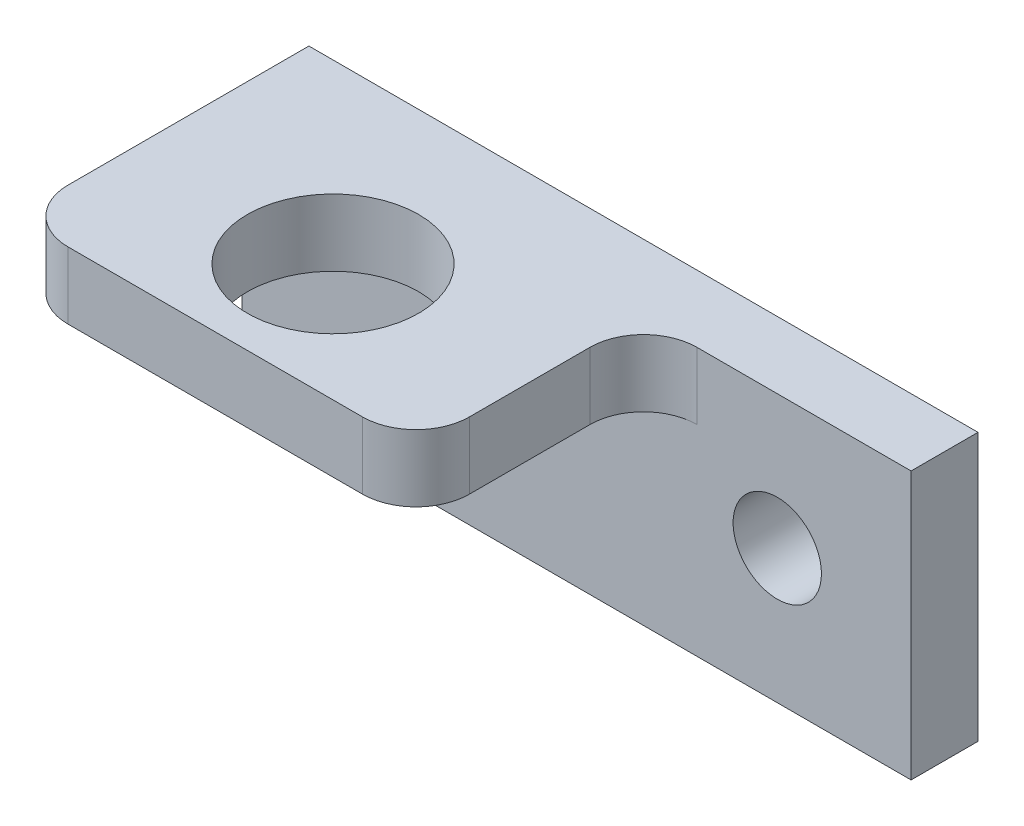
from build123d import *

# Parameters (mm, degrees)
SKIZZE1_W                       = 25
SKIZZE1_H                       = 10
SKIZZE1_R                       = 1.65
AUFSATZ_LINEAR_AUSTRAGEN1_DEPTH = 2.5
SKIZZE2_W                       = 15
SKIZZE2_H                       = 2.5
AUFSATZ_LINEAR_AUSTRAGEN2_DEPTH = 8.5
VERRUNDUNG1_R                   = 2
SKIZZE3_R                       = 3.2
SCHNITT_LINEAR_AUSTRAGEN1_DEPTH = 8.5


with BuildPart() as part:
    # Skizze1 → Aufsatz-Linear austragen1 (new body)
    with BuildSketch(Plane.XY):
        with Locations((12.5, 5)):
            Rectangle(SKIZZE1_W, SKIZZE1_H)
        with Locations((20, 5)):
            Circle(SKIZZE1_R, mode=Mode.SUBTRACT)
    extrude(amount=AUFSATZ_LINEAR_AUSTRAGEN1_DEPTH)

    # Skizze2 → Aufsatz-Linear austragen2 (add)
    with BuildSketch(Plane.XY.offset(2.5)):
        with Locations((7.5, 8.75)):
            Rectangle(SKIZZE2_W, SKIZZE2_H)
    extrude(amount=AUFSATZ_LINEAR_AUSTRAGEN2_DEPTH)

    # Verrundung1
    verrundung1_edges = [part.edges().sort_by_distance(p)[0] for p in [
        (15, 8.75, 2.5),
        (0, 8.75, 11),
        (15, 8.75, 11),
    ]]
    fillet(verrundung1_edges, radius=VERRUNDUNG1_R)

    # Skizze3 → Schnitt-Linear austragen1 (cut)
    with BuildSketch(Plane.XZ.offset(-7.5)):
        with Locations(Location((7.5, 6.6, 0), (0, 0, 270))):
            Circle(SKIZZE3_R)
    extrude(amount=-SCHNITT_LINEAR_AUSTRAGEN1_DEPTH, mode=Mode.SUBTRACT)


solid = part.part
